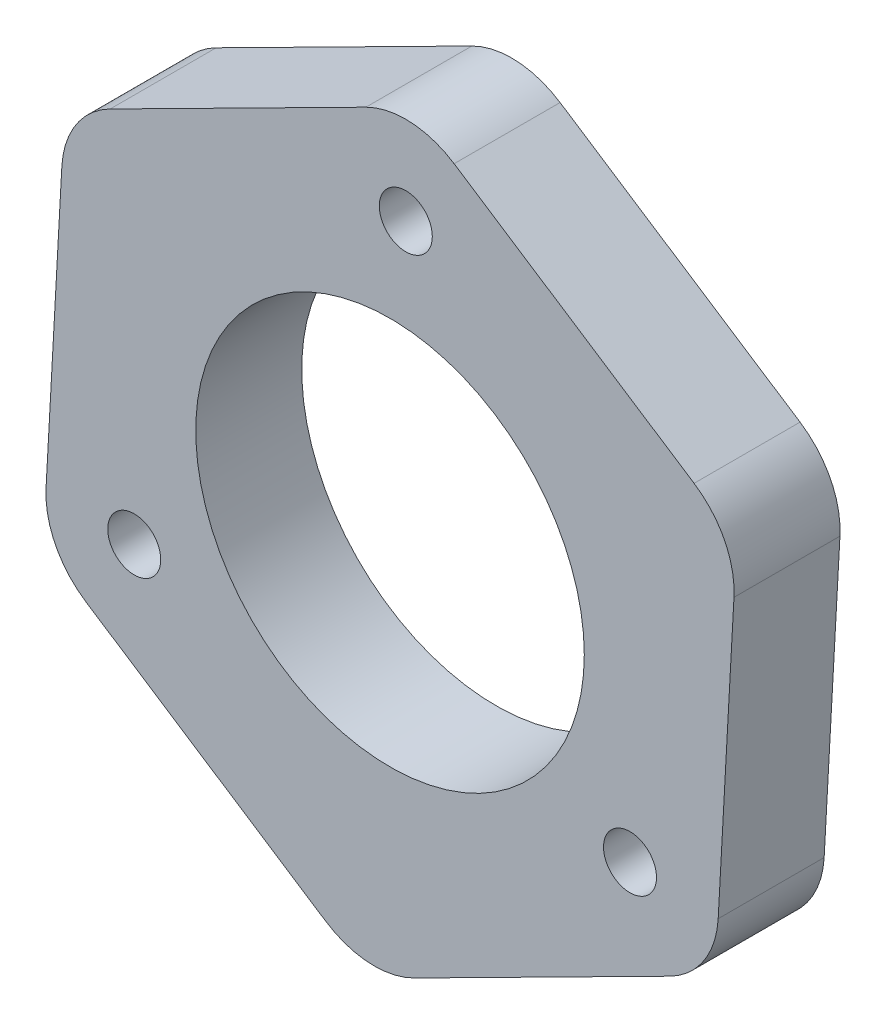
from build123d import *

# Parameters (mm, degrees)
SKETCH1_R           = 1.5
SKETCH1_R_2         = 11
BOSS_EXTRUDE1_DEPTH = 6


with BuildPart() as part:
    # Sketch1 → Boss-Extrude1 (new body)
    with BuildSketch(Plane.XY):
        with BuildLine():
            Line((-159.579510726, 269.565892844), (-145.098261144, 276.89435179))
            ThreePointArc((-145.098261144, 276.89435179), (-143.169689435, 278.62126324), (-142.362953068, 281.08109828))
            Line((-142.362953068, 281.08109828), (-141.468959895, 297.28645777))
            ThreePointArc((-141.468959895, 297.28645777), (-142.000224164, 299.82010744), (-143.727138152, 301.748679567))
            Line((-143.727138152, 301.748679567), (-157.314401932, 310.62556883))
            ThreePointArc((-157.314401932, 310.62556883), (-159.774237542, 311.432303912), (-162.307885519, 310.901040648))
            Line((-162.307885519, 310.901040648), (-176.789137502, 303.572586446))
            ThreePointArc((-176.789137502, 303.572586446), (-178.717709578, 301.845675236), (-179.524445578, 299.385839957))
            Line((-179.524445578, 299.385839957), (-180.418433441, 283.180480173))
            ThreePointArc((-180.418433441, 283.180480173), (-179.887169279, 280.64683253), (-178.160257198, 278.718261388))
            Line((-178.160257198, 278.718261388), (-164.572997879, 269.841365296))
            ThreePointArc((-164.572997879, 269.841365296), (-162.113160601, 269.034628864), (-159.579510726, 269.565892844))
        make_face()
        with Locations((-147.356435925, 281.356571316)):
            Circle(SKETCH1_R, mode=Mode.SUBTRACT)
        with Locations((-160.049709636, 306.438815317)):
            Circle(SKETCH1_R, mode=Mode.SUBTRACT)
        with Locations((-175.424950493, 282.905008773)):
            Circle(SKETCH1_R, mode=Mode.SUBTRACT)
        with Locations((-160.943697824, 290.233472162)):
            Circle(SKETCH1_R_2, mode=Mode.SUBTRACT)
    extrude(amount=BOSS_EXTRUDE1_DEPTH)


solid = part.part
